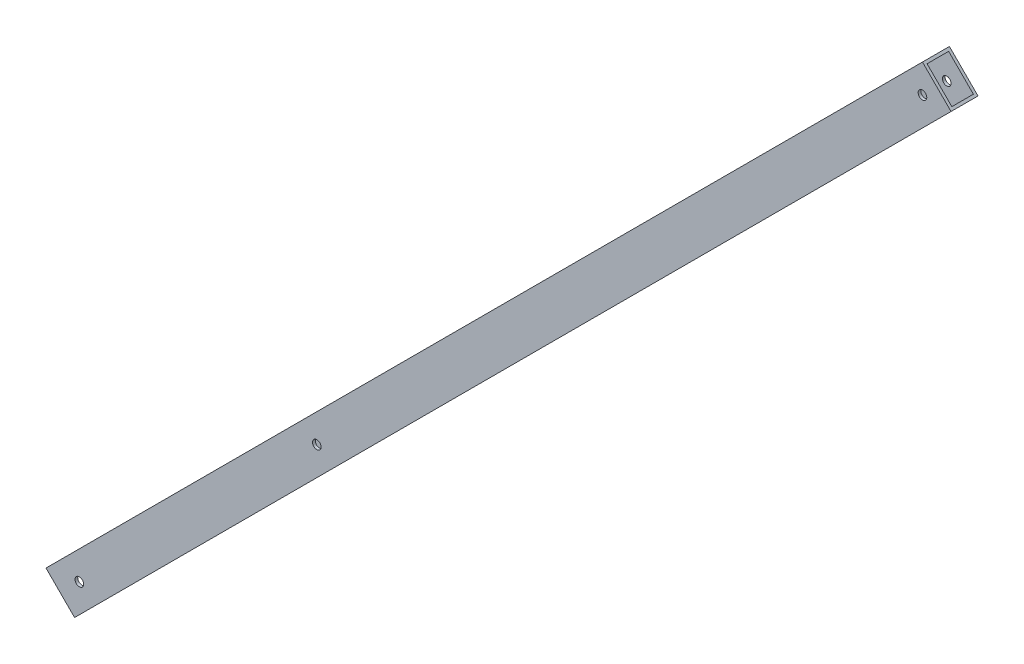
from build123d import *

# Parameters (mm, degrees)
SKETCH_1_R          = 1.6
EXTRUDE_1_DEPTH     = 10
SKETCH_2_W          = 8
SKETCH_2_H          = 13
CUT_EXTRUDE_1_DEPTH = 1000


with BuildPart() as part:
    # ｽｹｯﾁ1 → ﾎﾞｽ - 押し出し1 (new body)
    with BuildSketch(Plane.XY):
        Polygon((325.269119346, 325.269119346), (335.875721064, 314.662517628), (10.606601718, -10.606601718), (0, 0), align=None)
        with Locations((100.519119346, 89.912517628)):
            Circle(SKETCH_1_R, mode=Mode.SUBTRACT)
        with Locations((12.374368671, 1.767766953)):
            Circle(SKETCH_1_R, mode=Mode.SUBTRACT)
        with Locations((325.269119346, 314.662517628)):
            Circle(SKETCH_1_R, mode=Mode.SUBTRACT)
    extrude(amount=EXTRUDE_1_DEPTH)

    # ｽｹｯﾁ2 → ｶｯﾄ - 押し出し1 (cut)
    with BuildSketch(Plane(origin=(0, 0, 0), x_dir=(0, 0, 1), z_dir=(-0.7071067811865517, -0.7071067811865435, 0))):
        with Locations((5, -7.5)):
            Rectangle(SKETCH_2_W, SKETCH_2_H)
    extrude(amount=-CUT_EXTRUDE_1_DEPTH, mode=Mode.SUBTRACT)


solid = part.part
